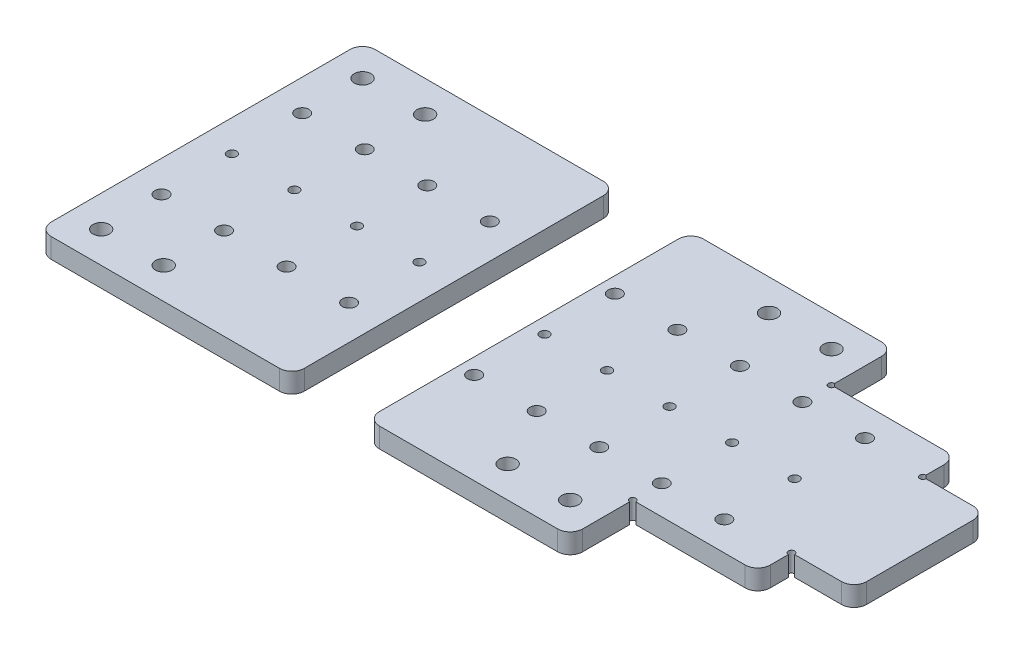
from build123d import *

# Parameters (mm, degrees)
BOSS_EXTRUDE1_DEPTH = 6.35
SKETCH2_R           = 2.65
SKETCH2_R_2         = 2.15
SKETCH2_R_3         = 1.5
CUT_EXTRUDE1_DEPTH  = 200.181531523
SKETCH3_R           = 1
CUT_EXTRUDE2_DEPTH  = 200.181531523
SKETCH4_W           = 24
SKETCH4_H           = 103.6
CUT_EXTRUDE3_DEPTH  = 10
FILLET1_R           = 4
FILLET2_R           = 4


with BuildPart() as part:
    # Sketch1 → Boss-Extrude1 (new body)
    with BuildSketch(Plane(origin=(0, 0, 0), x_dir=(1, 0, 0), z_dir=(0, 1, 0))):
        Polygon((0, 103.6), (0, 83.6), (40, 83.6), (40, 72.8), (60, 72.8), (60, 30.8), (40, 30.8), (40, 20), (0, 20), (0, 0), (-170, 0), (-170, 103.6), align=None)
    extrude(amount=BOSS_EXTRUDE1_DEPTH)

    # Sketch2 → Cut-Extrude1 (cut, through all)
    with BuildSketch(Plane(origin=(0, 6.35, 0), x_dir=(1, 0, 0), z_dir=(0, 1, 0))):
        with Locations(Location((-160, 93.6, 0), (0, 0, 270))):
            Circle(SKETCH2_R)
        with Locations(Location((-140, 93.6, 0), (0, 0, 270))):
            Circle(SKETCH2_R)
        with Locations(Location((-30, 93.6, 0), (0, 0, 90))):
            Circle(SKETCH2_R)
        with Locations(Location((-10, 93.6, 0), (0, 0, 90))):
            Circle(SKETCH2_R)
        with Locations(Location((-140, 10, 0), (0, 0, 90))):
            Circle(SKETCH2_R)
        with Locations(Location((-160, 10, 0), (0, 0, 90))):
            Circle(SKETCH2_R)
        with Locations(Location((-30, 10, 0), (0, 0, 270))):
            Circle(SKETCH2_R)
        with Locations(Location((-10, 10, 0), (0, 0, 270))):
            Circle(SKETCH2_R)
        with Locations(Location((-85, 93.6, 0), (0, 0, 270))):
            Circle(SKETCH2_R)
        with Locations(Location((-85, 10, 0), (0, 0, 90))):
            Circle(SKETCH2_R)
        with Locations(Location((-160, 74.3, 0), (0, 0, 270))):
            Circle(SKETCH2_R_2)
        with Locations(Location((-140, 74.3, 0), (0, 0, 270))):
            Circle(SKETCH2_R_2)
        with Locations(Location((-120, 74.3, 0), (0, 0, 270))):
            Circle(SKETCH2_R_2)
        with Locations(Location((-100, 74.3, 0), (0, 0, 270))):
            Circle(SKETCH2_R_2)
        with Locations(Location((-80, 74.3, 0), (0, 0, 270))):
            Circle(SKETCH2_R_2)
        with Locations(Location((-60, 74.3, 0), (0, 0, 270))):
            Circle(SKETCH2_R_2)
        with Locations(Location((-40, 74.3, 0), (0, 0, 270))):
            Circle(SKETCH2_R_2)
        with Locations(Location((-20, 74.3, 0), (0, 0, 270))):
            Circle(SKETCH2_R_2)
        with Locations(Location((0, 74.3, 0), (0, 0, 270))):
            Circle(SKETCH2_R_2)
        with Locations(Location((0, 29.3, 0), (0, 0, 90))):
            Circle(SKETCH2_R_2)
        with Locations(Location((-20, 29.3, 0), (0, 0, 90))):
            Circle(SKETCH2_R_2)
        with Locations(Location((-40, 29.3, 0), (0, 0, 90))):
            Circle(SKETCH2_R_2)
        with Locations(Location((-60, 29.3, 0), (0, 0, 90))):
            Circle(SKETCH2_R_2)
        with Locations(Location((-80, 29.3, 0), (0, 0, 90))):
            Circle(SKETCH2_R_2)
        with Locations(Location((-100, 29.3, 0), (0, 0, 90))):
            Circle(SKETCH2_R_2)
        with Locations(Location((-120, 29.3, 0), (0, 0, 90))):
            Circle(SKETCH2_R_2)
        with Locations(Location((-140, 29.3, 0), (0, 0, 90))):
            Circle(SKETCH2_R_2)
        with Locations(Location((-160, 29.3, 0), (0, 0, 90))):
            Circle(SKETCH2_R_2)
        with Locations(Location((-140, 51.8, 0), (0, 0, 270))):
            Circle(SKETCH2_R_3)
        with Locations(Location((-120, 51.8, 0), (0, 0, 270))):
            Circle(SKETCH2_R_3)
        with Locations(Location((-100, 51.8, 0), (0, 0, 270))):
            Circle(SKETCH2_R_3)
        with Locations(Location((-80, 51.8, 0), (0, 0, 270))):
            Circle(SKETCH2_R_3)
        with Locations(Location((-60, 51.8, 0), (0, 0, 270))):
            Circle(SKETCH2_R_3)
        with Locations(Location((-40, 51.8, 0), (0, 0, 270))):
            Circle(SKETCH2_R_3)
        with Locations(Location((-20, 51.8, 0), (0, 0, 270))):
            Circle(SKETCH2_R_3)
        with Locations(Location((0, 51.8, 0), (0, 0, 270))):
            Circle(SKETCH2_R_3)
        with Locations(Location((20, 74.3, 0), (0, 0, 270))):
            Circle(SKETCH2_R_2)
        with Locations(Location((20, 29.3, 0), (0, 0, 90))):
            Circle(SKETCH2_R_2)
        with Locations(Location((20, 51.8, 0), (0, 0, 270))):
            Circle(SKETCH2_R_3)
        with Locations(Location((-160, 51.8, 0), (0, 0, 270))):
            Circle(SKETCH2_R_3)
    extrude(amount=-CUT_EXTRUDE1_DEPTH, mode=Mode.SUBTRACT)

    # Sketch3 → Cut-Extrude2 (cut, through all)
    with BuildSketch(Plane(origin=(0, 6.35, 0), x_dir=(1, 0, 0), z_dir=(0, 1, 0))):
        with Locations((0, 83.6)):
            Circle(SKETCH3_R)
        with Locations((0, 20)):
            Circle(SKETCH3_R)
        with Locations((40, 30.8)):
            Circle(SKETCH3_R)
        with Locations((40, 72.8)):
            Circle(SKETCH3_R)
    extrude(amount=-CUT_EXTRUDE2_DEPTH, mode=Mode.SUBTRACT)

    # Sketch4 → Cut-Extrude3 (cut)
    with BuildSketch(Plane(origin=(0, 6.35, 0), x_dir=(1, 0, 0), z_dir=(0, 1, 0))):
        with Locations((-77, 51.8)):
            Rectangle(SKETCH4_W, SKETCH4_H)
    extrude(amount=-CUT_EXTRUDE3_DEPTH, mode=Mode.SUBTRACT)


with BuildPart() as cut_extrude3_piece_1:
    # of the separate pieces the step leaves, piece 1, a body of its own (cut_extrude3_pieces)
    add(part.part.solids().sort_by_distance((0, 0, -103.6))[0])

    # Fillet1
    fillet1_edges = [cut_extrude3_piece_1.edges().sort_by_distance(p)[0] for p in [
        (0, 3.175, 0),
        (0, 3.175, -103.6),
        (40, 3.175, -83.6),
        (60, 3.175, -72.8),
        (60, 3.175, -30.8),
        (40, 3.175, -20),
        (-65, 3.175, -103.6),
        (-65, 3.175, 0),
    ]]
    fillet(fillet1_edges, radius=FILLET1_R)


with BuildPart() as cut_extrude3_piece_2:
    # of the separate pieces the step leaves, piece 2, a body of its own (cut_extrude3_pieces)
    add(part.part.solids().sort_by_distance((-170, 0, 0))[0])

    # Fillet2
    fillet2_edges = [cut_extrude3_piece_2.edges().sort_by_distance(p)[0] for p in [
        (-89, 3.175, 0),
        (-170, 3.175, 0),
        (-170, 3.175, -103.6),
        (-89, 3.175, -103.6),
    ]]
    fillet(fillet2_edges, radius=FILLET2_R)


solid = Compound([cut_extrude3_piece_1.part, cut_extrude3_piece_2.part])
